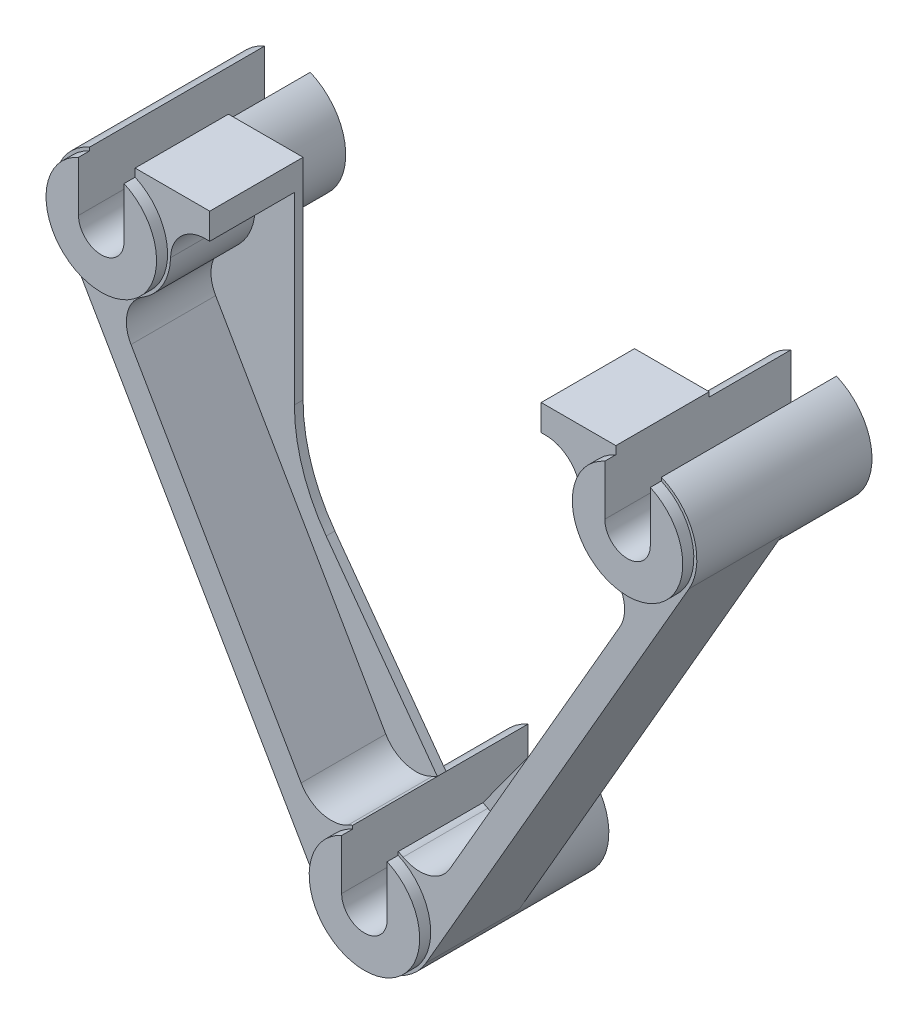
from build123d import *

# Parameters (mm, degrees)
SKETCH1_R           = 1.5
BOSS_EXTRUDE1_DEPTH = 12
SKETCH2_R           = 6.695859604
BOSS_EXTRUDE2_DEPTH = 9.4028
CUT_EXTRUDE2_DEPTH  = 64.105652153
HOLE1_D             = 5.2324
CUT_EXTRUDE3_DEPTH  = 11
SKETCH8_R           = 19.05
CUT_EXTRUDE4_DEPTH  = 10
SKETCH9_R           = 6.35
CUT_EXTRUDE6_DEPTH  = 1.27
CUT_EXTRUDE7_DEPTH  = 60.624425826


with BuildPart() as part:
    # Sketch1 → Boss-Extrude1 (new body)
    with BuildSketch(Plane.XY):
        Polygon((-40.843506262, 22.426308796), (-1, -46.5846684), (1, -46.5846684), (40.843506262, 22.426308796), (39.843506262, 24.158359604), (-39.843506262, 24.158359604), align=None)
        with Locations((-30.245937227, 17.4625)):
            Circle(SKETCH1_R, mode=Mode.SUBTRACT)
        with Locations((30.245937227, 17.4625)):
            Circle(SKETCH1_R, mode=Mode.SUBTRACT)
        with Locations((0, -34.925)):
            Circle(SKETCH1_R, mode=Mode.SUBTRACT)
    extrude(amount=BOSS_EXTRUDE1_DEPTH)

    # Sketch2 → Boss-Extrude2 (add)
    with BuildSketch(Plane(origin=(0, 0, 0), x_dir=(-1, 0, 0), z_dir=(0, 0, -1))):
        with Locations(Location((30.245937227, 17.4625, 0), (0, 0, 90))):
            Circle(SKETCH2_R)
        with Locations(Location((-30.245937227, 17.4625, 0), (0, 0, 210))):
            Circle(SKETCH2_R)
        with Locations(Location((0, -34.925, 0), (0, 0, 210))):
            Circle(SKETCH2_R)
    extrude(amount=BOSS_EXTRUDE2_DEPTH)

    # Sketch3 → Cut-Extrude2 (cut, through all)
    with BuildSketch(Plane(origin=(0, 0, 0), x_dir=(-1, 0, 0), z_dir=(0, 0, -1))):
        with BuildLine():
            Line((-5.798784517, -38.272929802), (-1, -46.5846684))
            Line((-1, -46.5846684), (1, -46.5846684))
            Line((1, -46.5846684), (5.798784517, -38.272929802))
            ThreePointArc((5.798784517, -38.272929802), (0, -41.620859604), (-5.798784517, -38.272929802))
        make_face()
        with BuildLine():
            Line((-30.245937227, 24.158359604), (-39.843506262, 24.158359604))
            Line((-39.843506262, 24.158359604), (-40.843506262, 22.426308796))
            Line((-40.843506262, 22.426308796), (-36.044721744, 14.114570198))
            ThreePointArc((-36.044721744, 14.114570198), (-36.044721744, 20.810429802), (-30.245937227, 24.158359604))
        make_face()
        with BuildLine():
            Line((36.044721744, 14.114570198), (40.843506262, 22.426308796))
            Line((40.843506262, 22.426308796), (39.843506262, 24.158359604))
            Line((39.843506262, 24.158359604), (30.245937227, 24.158359604))
            ThreePointArc((30.245937227, 24.158359604), (36.044721744, 20.810429802), (36.044721744, 14.114570198))
        make_face()
    extrude(amount=-CUT_EXTRUDE2_DEPTH, mode=Mode.SUBTRACT)

    # Hole1 (through all)
    with Locations(Plane.XY.offset(12)):
        with Locations((-30.245937227, 17.4625), (30.245937227, 17.4625), (0, -34.925)):
            Hole(HOLE1_D / 2)

    # Sketch7 → Cut-Extrude3 (cut)
    with BuildSketch(Plane.XY.offset(12)):
        with BuildLine():
            Line((-19.554402665, 21.158359604), (19.554402665, 21.158359604))
            ThreePointArc((19.554402665, 21.158359604), (22.342326137, 20.026718493), (23.552785201, 17.272100961))
            ThreePointArc((23.552785201, 17.272100961), (24.44715271, 14.114570198), (26.734470809, 11.761259834))
            ThreePointArc((26.734470809, 11.761259834), (28.514810038, 9.335662768), (28.100878252, 6.355429662))
            Line((28.100878252, 6.355429662), (8.546475587, -27.513789266))
            ThreePointArc((8.546475587, -27.513789266), (6.1724839, -29.362381261), (3.181685608, -29.033360795))
            ThreePointArc((3.181685608, -29.033360795), (0, -28.229140396), (-3.181685608, -29.033360795))
            ThreePointArc((-3.181685608, -29.033360795), (-6.1724839, -29.362381261), (-8.546475587, -27.513789266))
            Line((-8.546475587, -27.513789266), (-28.100878252, 6.355429662))
            ThreePointArc((-28.100878252, 6.355429662), (-28.514810038, 9.335662768), (-26.734470809, 11.761259834))
            ThreePointArc((-26.734470809, 11.761259834), (-24.44715271, 14.114570198), (-23.552785201, 17.272100961))
            ThreePointArc((-23.552785201, 17.272100961), (-22.342326137, 20.026718493), (-19.554402665, 21.158359604))
        make_face()
    extrude(amount=-CUT_EXTRUDE3_DEPTH, mode=Mode.SUBTRACT)

    # Sketch8 → Cut-Extrude4 (cut)
    with BuildSketch(Plane.XY.offset(1)):
        Circle(SKETCH8_R)
    extrude(amount=-CUT_EXTRUDE4_DEPTH, mode=Mode.SUBTRACT)

    # Sketch9 → Cut-Extrude6 (cut)
    with BuildSketch(Plane.XY.offset(12)):
        with BuildLine():
            Line((5.798784517, -38.272929802), (36.044721744, 14.114570198))
            ThreePointArc((36.044721744, 14.114570198), (36.044721744, 20.810429802), (30.245937227, 24.158359604))
            Line((30.245937227, 24.158359604), (-30.245937227, 24.158359604))
            ThreePointArc((-30.245937227, 24.158359604), (-36.044721744, 20.810429802), (-36.044721744, 14.114570198))
            Line((-36.044721744, 14.114570198), (-5.798784517, -38.272929802))
            ThreePointArc((-5.798784517, -38.272929802), (0, -41.620859604), (5.798784517, -38.272929802))
        make_face()
        with Locations((-30.245937227, 17.4625)):
            Circle(SKETCH9_R, mode=Mode.SUBTRACT)
        with Locations((30.245937227, 17.4625)):
            Circle(SKETCH9_R, mode=Mode.SUBTRACT)
        with Locations((0, -34.925)):
            Circle(SKETCH9_R, mode=Mode.SUBTRACT)
    extrude(amount=-CUT_EXTRUDE6_DEPTH, mode=Mode.SUBTRACT)

    # Sketch10 → Cut-Extrude7 (cut, through all)
    with BuildSketch(Plane.XY.offset(12)):
        with BuildLine():
            Line((-32.862137227, 17.4625), (-32.862137227, 23.626105552))
            ThreePointArc((-32.862137227, 23.626105552), (-31.580833929, 24.023946992), (-30.245937227, 24.158359604))
            Line((-30.245937227, 24.158359604), (-27.629737227, 24.158359604))
            Line((-27.629737227, 24.158359604), (-27.629737227, 17.4625))
            ThreePointArc((-27.629737227, 17.4625), (-30.245937227, 14.8463), (-32.862137227, 17.4625))
        make_face()
        with BuildLine():
            Line((30.245937227, 24.158359604), (27.629737227, 24.158359604))
            Line((27.629737227, 24.158359604), (27.629737227, 17.4625))
            ThreePointArc((27.629737227, 17.4625), (30.245937227, 14.8463), (32.862137227, 17.4625))
            Line((32.862137227, 17.4625), (32.862137227, 23.626105552))
            ThreePointArc((32.862137227, 23.626105552), (31.580833929, 24.023946992), (30.245937227, 24.158359604))
        make_face()
        with BuildLine():
            Line((-19.05, 0), (-19.05, 24.158359604))
            Line((-19.05, 24.158359604), (19.05, 24.158359604))
            Line((19.05, 24.158359604), (19.05, 0))
            ThreePointArc((19.05, 0), (18.113838196, -5.898420621), (15.397363169, -11.217116717))
            Line((15.397363169, -11.217116717), (2.6162, -28.761394448))
            Line((2.6162, -28.761394448), (2.6162, -34.925))
            ThreePointArc((2.6162, -34.925), (0, -37.5412), (-2.6162, -34.925))
            Line((-2.6162, -34.925), (-2.6162, -28.761394448))
            Line((-2.6162, -28.761394448), (-15.397363169, -11.217116717))
            ThreePointArc((-15.397363169, -11.217116717), (-18.113838196, -5.898420621), (-19.05, 0))
        make_face()
    extrude(amount=-CUT_EXTRUDE7_DEPTH, mode=Mode.SUBTRACT)


solid = part.part
